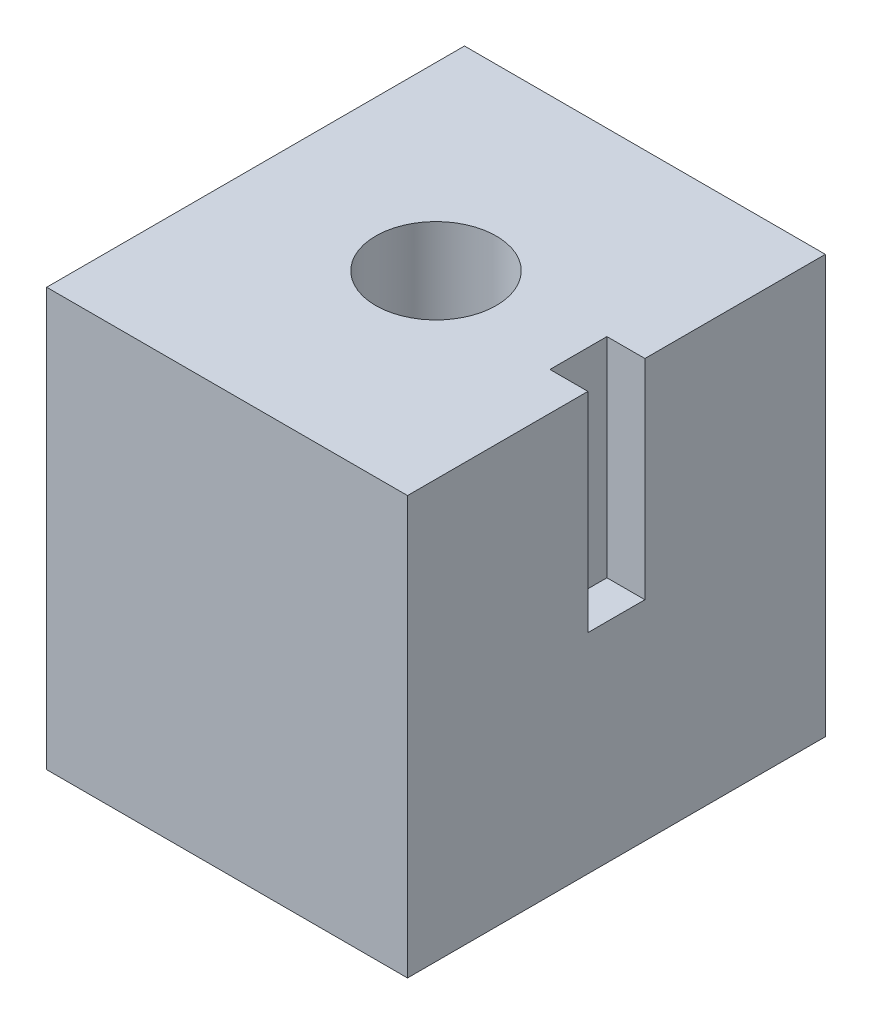
from build123d import *

# Parameters (mm, degrees)
SKETCH1_W           = 19
SKETCH1_H           = 22
BOSS_EXTRUDE1_DEPTH = 22
SKETCH2_R           = 3.175
CUT_EXTRUDE1_DEPTH  = 22
SKETCH3_R           = 7.5
CUT_EXTRUDE2_DEPTH  = 5.5
SKETCH4_W           = 2
SKETCH4_H           = 3
CUT_EXTRUDE5_DEPTH  = 11


with BuildPart() as part:
    # Sketch1 → Boss-Extrude1 (new body)
    with BuildSketch(Plane(origin=(0, 0, 0), x_dir=(1, 0, 0), z_dir=(0, 1, 0))):
        Rectangle(SKETCH1_W, SKETCH1_H)
    extrude(amount=-BOSS_EXTRUDE1_DEPTH)

    # Sketch2 → Cut-Extrude1 (cut)
    with BuildSketch(Plane(origin=(0, 0, 0), x_dir=(1, 0, 0), z_dir=(0, 1, 0))):
        with Locations(Location((0, 0, 0), (0, 0, 270))):
            Circle(SKETCH2_R)
    extrude(amount=-CUT_EXTRUDE1_DEPTH, mode=Mode.SUBTRACT)

    # Sketch3 → Cut-Extrude2 (cut)
    with BuildSketch(Plane.XZ.offset(22)):
        with Locations(Location((0, 0, 0), (0, 0, 270))):
            Circle(SKETCH3_R)
    extrude(amount=-CUT_EXTRUDE2_DEPTH, mode=Mode.SUBTRACT)

    # Sketch4 → Cut-Extrude5 (cut)
    with BuildSketch(Plane(origin=(0, 0, 0), x_dir=(1, 0, 0), z_dir=(0, 1, 0))):
        with Locations((8.5, 0)):
            Rectangle(SKETCH4_W, SKETCH4_H)
    extrude(amount=-CUT_EXTRUDE5_DEPTH, mode=Mode.SUBTRACT)


solid = part.part
